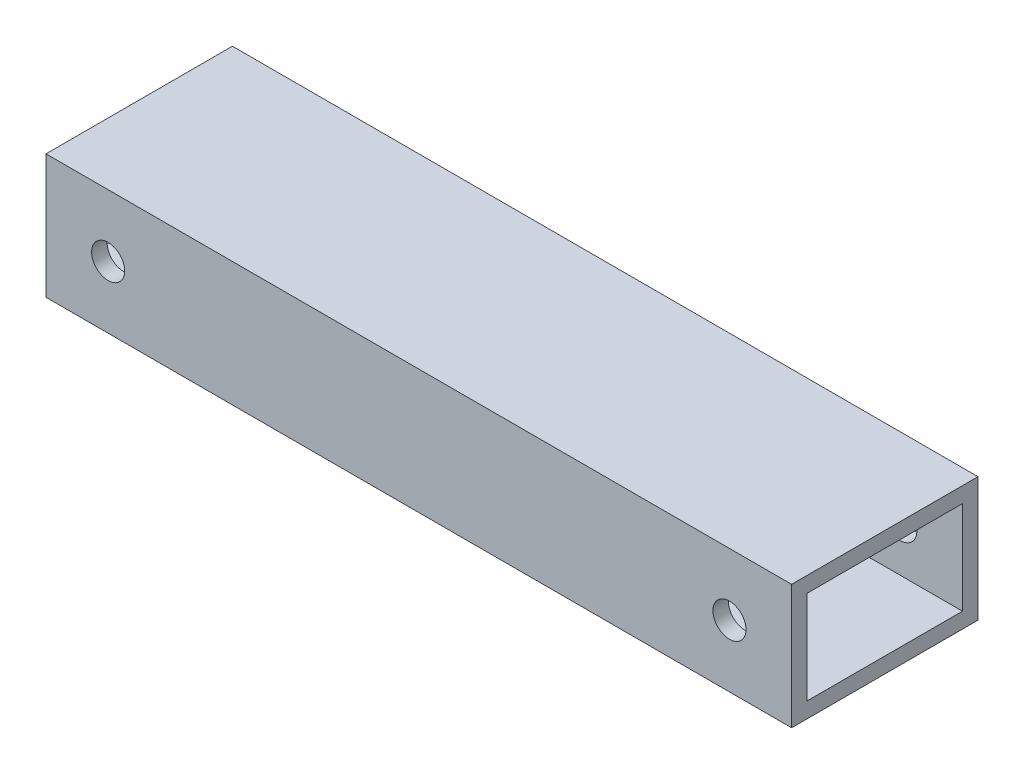
from build123d import *

# Parameters (mm, degrees)
SKETCH1_W           = 38.1
SKETCH1_H           = 25.4
SKETCH1_W_2         = 31.75
SKETCH1_H_2         = 19.05
EXTRUDE_THIN1_DEPTH = 152.4
SKETCH2_R           = 3.3782
CUT_EXTRUDE1_DEPTH  = 160.130543894


with BuildPart() as part:
    # Sketch1 → Extrude-Thin1 (new body)
    with BuildSketch(Plane(origin=(0, 0, 0), x_dir=(0, 0, -1), z_dir=(1, 0, 0))):
        with Locations((19.05, 12.7)):
            Rectangle(SKETCH1_W, SKETCH1_H)
        with Locations((19.05, 12.7)):
            Rectangle(SKETCH1_W_2, SKETCH1_H_2, mode=Mode.SUBTRACT)
    extrude(amount=EXTRUDE_THIN1_DEPTH)

    # Sketch2 → Cut-Extrude1 (cut, through all)
    with BuildSketch(Plane.XY):
        with Locations((12.7, 12.7)):
            Circle(SKETCH2_R)
        with Locations((139.7, 12.7)):
            Circle(SKETCH2_R)
    extrude(amount=-CUT_EXTRUDE1_DEPTH, mode=Mode.SUBTRACT)


solid = part.part
